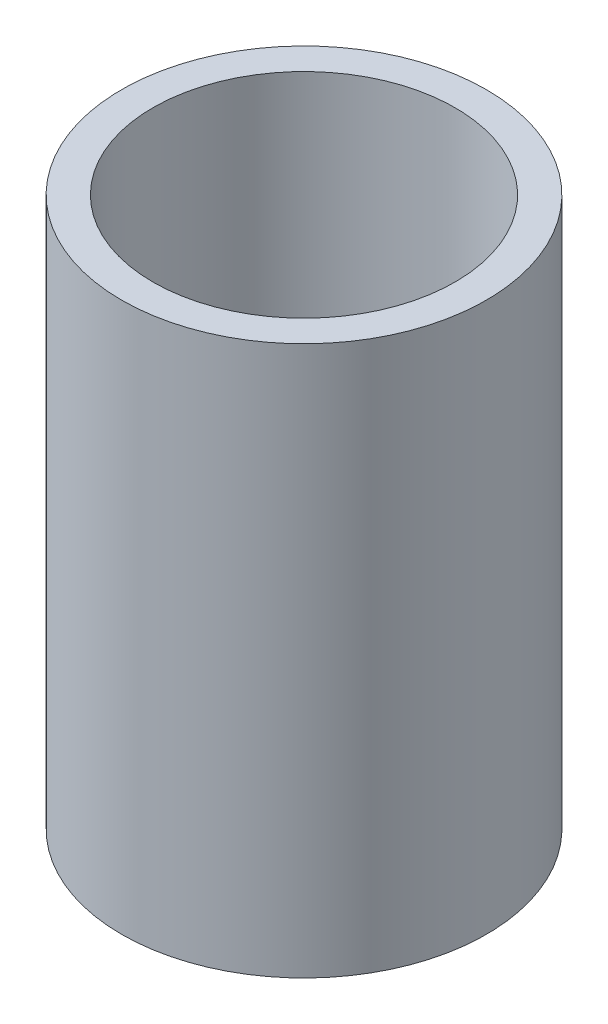
from build123d import *

# Parameters (mm, degrees)
SKETCH1_R           = 21.082
SKETCH1_R_2         = 17.4625
BOSS_EXTRUDE1_DEPTH = 63.5


with BuildPart() as part:
    # Sketch1 → Boss-Extrude1 (new body)
    with BuildSketch(Plane(origin=(0, 0, 0), x_dir=(1, 0, 0), z_dir=(0, 1, 0))):
        with Locations(Location((0, 0, 0), (0, 0, 270))):
            Circle(SKETCH1_R)
        with Locations(Location((0, 0, 0), (0, 0, 270))):
            Circle(SKETCH1_R_2, mode=Mode.SUBTRACT)
    extrude(amount=BOSS_EXTRUDE1_DEPTH)


solid = part.part
